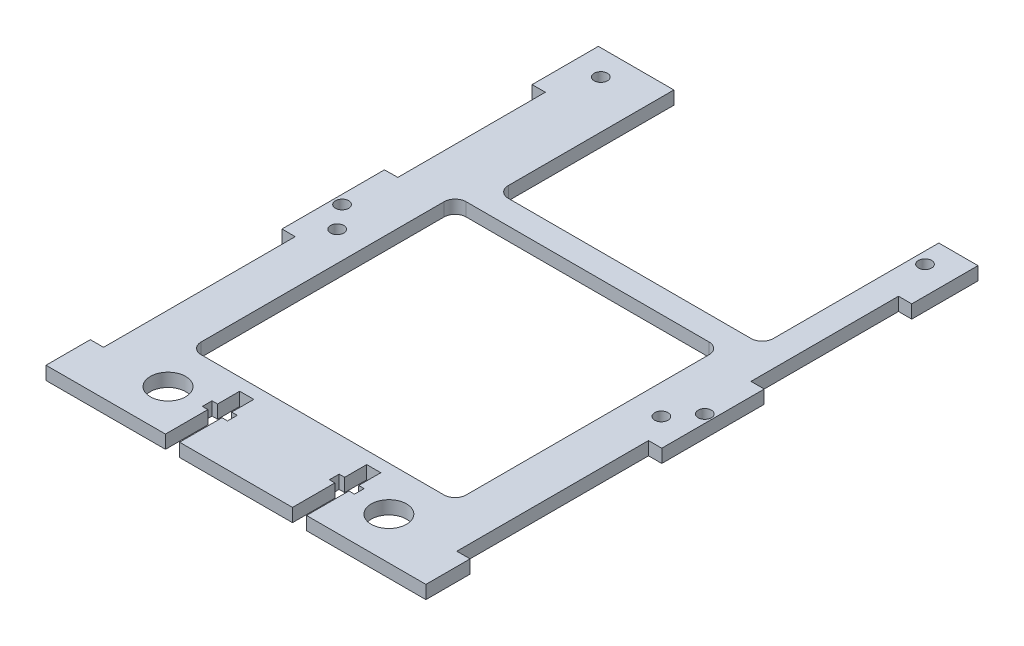
from build123d import *

# Parameters (mm, degrees)
SKETCH1_R           = 1.5
SKETCH1_R_2         = 4
BOSS_EXTRUDE2_DEPTH = 3


with BuildPart() as part:
    # Sketch1 → Boss-Extrude2 (new body)
    with BuildSketch(Plane(origin=(0, 0, 0), x_dir=(1, 0, 0), z_dir=(0, 1, 0))):
        with BuildLine():
            Line((-43, 65.026712015), (-25.898177638, 65.026712015))
            Line((-25.898177638, 65.026712015), (-25.898177638, 27.526712015))
            ThreePointArc((-25.898177638, 27.526712015), (-25.165944591, 25.758945062), (-23.398177638, 25.026712015))
            Line((-23.398177638, 25.026712015), (31.601822362, 25.026712015))
            ThreePointArc((31.601822362, 25.026712015), (33.369636089, 25.758964437), (34.101888511, 27.526778164))
            Line((34.101888511, 27.526778164), (34.101888511, 65.008591724))
            Line((34.101888511, 65.008591724), (42.973532608, 65.008591724))
            Line((42.973532608, 65.008591724), (42.973532608, 50.008591724))
            Line((42.973532608, 50.008591724), (39.974710246, 50.008591724))
            Line((39.974710246, 50.008591724), (39.974710246, 16.608591724))
            Line((39.974710246, 16.608591724), (42.974710246, 16.608591724))
            Line((42.974710246, 16.608591724), (42.974710246, -6.591408276))
            Line((42.974710246, -6.591408276), (39.974710246, -6.591408276))
            Line((39.974710246, -6.591408276), (39.974710246, -49.991408276))
            Line((39.974710246, -49.991408276), (42.974710246, -49.991408276))
            Line((42.974710246, -49.991408276), (42.974710246, -59.991408276))
            Line((42.974710246, -59.991408276), (15.954710246, -59.991408276))
            Line((15.954710246, -59.991408276), (15.954710246, -50.391457529))
            Line((15.954710246, -50.391457529), (17.204695418, -50.391457529))
            Line((17.204695418, -50.391457529), (17.204695418, -48.200049254))
            Line((17.204695418, -48.200049254), (15.979985173, -48.200049254))
            Line((15.979985173, -48.200049254), (15.979985173, -43.200049254))
            Line((15.979985173, -43.200049254), (12.779985173, -43.200049254))
            Line((12.779985173, -43.200049254), (12.779985173, -48.200049254))
            Line((12.779985173, -48.200049254), (11.529985173, -48.200049254))
            Line((11.529985173, -48.200049254), (11.529985173, -50.400049254))
            Line((11.529985173, -50.400049254), (12.779985173, -50.400049254))
            Line((12.779985173, -50.400049254), (12.779985173, -60.000049254))
            Line((12.779985173, -60.000049254), (-12.780014827, -60.000049254))
            Line((-12.780014827, -60.000049254), (-12.780014827, -50.400049254))
            Line((-12.780014827, -50.400049254), (-11.530014827, -50.400049254))
            Line((-11.530014827, -50.400049254), (-11.530014827, -48.200049254))
            Line((-11.530014827, -48.200049254), (-12.780014827, -48.200049254))
            Line((-12.780014827, -48.200049254), (-12.780014827, -43.200049254))
            Line((-12.780014827, -43.200049254), (-15.980014827, -43.200049254))
            Line((-15.980014827, -43.200049254), (-15.980014827, -48.200049254))
            Line((-15.980014827, -48.200049254), (-17.230014827, -48.200049254))
            Line((-17.230014827, -48.200049254), (-17.230014827, -50.400049254))
            Line((-17.230014827, -50.400049254), (-15.980014827, -50.400049254))
            Line((-15.980014827, -50.400049254), (-15.980014827, -60.000049254))
            Line((-15.980014827, -60.000049254), (-43, -60.028356008))
            Line((-43, -60.028356008), (-43, -50))
            Line((-43, -50), (-40, -50))
            Line((-40, -50), (-40, -6.6))
            Line((-40, -6.6), (-43, -6.6))
            Line((-43, -6.6), (-43, 16.6))
            Line((-43, 16.6), (-40, 16.626712015))
            Line((-40, 16.626712015), (-40, 50.026712015))
            Line((-40, 50.026712015), (-43, 50.026712015))
            Line((-43, 50.026712015), (-43, 65.026712015))
        make_face()
        with Locations(Location((-41, 5, 0), (0, 0, 270))):
            Circle(SKETCH1_R, mode=Mode.SUBTRACT)
        with Locations(Location((-36.703, 59.285, 0), (0, 0, 270))):
            Circle(SKETCH1_R, mode=Mode.SUBTRACT)
        with Locations(Location((36.703, 59.285, 0), (0, 0, 270))):
            Circle(SKETCH1_R, mode=Mode.SUBTRACT)
        with Locations(Location((-36.703, -0.405, 0), (0, 0, 270))):
            Circle(SKETCH1_R, mode=Mode.SUBTRACT)
        with Locations(Location((36.703, -0.405, 0), (0, 0, 270))):
            Circle(SKETCH1_R, mode=Mode.SUBTRACT)
        with Locations(Location((-25, -50.405, 0), (0, 0, 270))):
            Circle(SKETCH1_R_2, mode=Mode.SUBTRACT)
        with Locations(Location((25, -50.400049254, 0), (0, 0, 270))):
            Circle(SKETCH1_R_2, mode=Mode.SUBTRACT)
        with Locations(Location((41.13223265, 5, 0), (0, 0, 270))):
            Circle(SKETCH1_R, mode=Mode.SUBTRACT)
        with BuildLine():
            Line((0, -40.405), (27.5, -40.405))
            ThreePointArc((27.5, -40.405), (29.267766953, -39.672766953), (30, -37.905))
            Line((30, -37.905), (30, 17.095))
            ThreePointArc((30, 17.095), (29.267766953, 18.862766953), (27.5, 19.595))
            Line((27.5, 19.595), (0, 19.595))
            Line((0, 19.595), (-27.5, 19.595))
            ThreePointArc((-27.5, 19.595), (-29.267766953, 18.862766953), (-30, 17.095))
            Line((-30, 17.095), (-30, -37.905))
            ThreePointArc((-30, -37.905), (-29.267766953, -39.672766953), (-27.5, -40.405))
            Line((-27.5, -40.405), (0, -40.405))
        make_face(mode=Mode.SUBTRACT)
    extrude(amount=BOSS_EXTRUDE2_DEPTH)


solid = part.part
